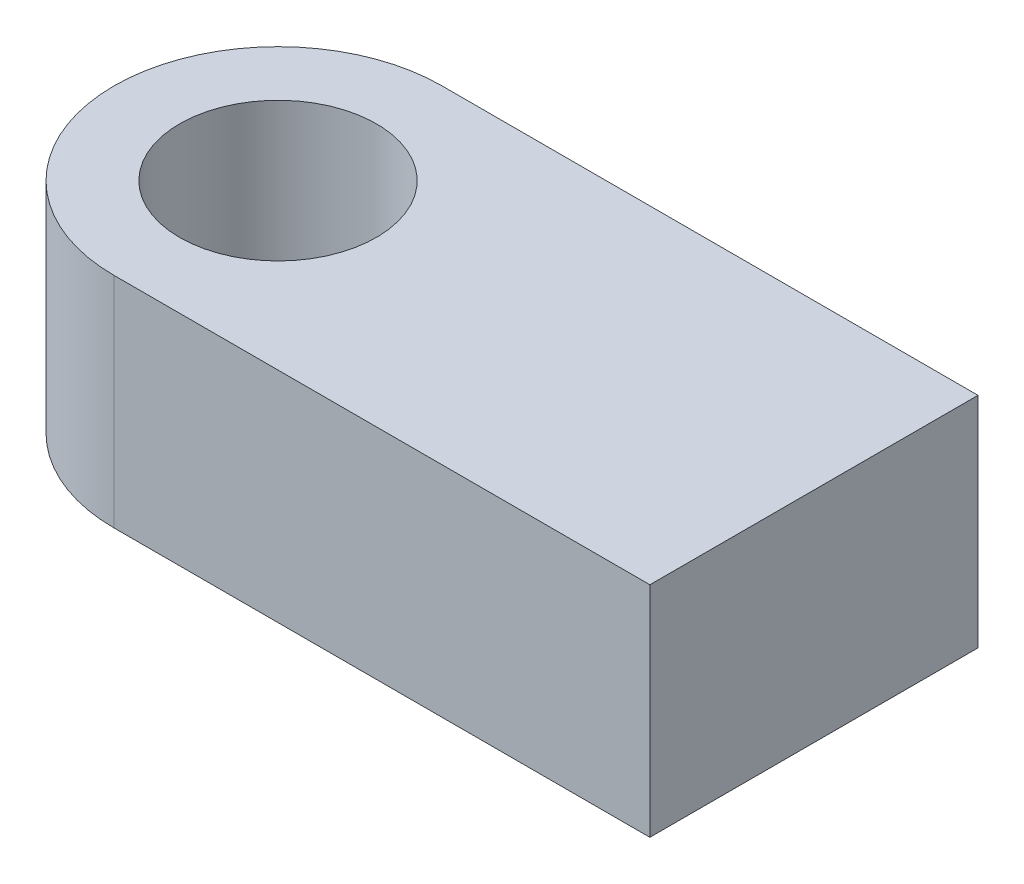
from build123d import *

# Parameters (mm, degrees)
SKETCH_1_R      = 4.5
EXTRUDE_1_DEPTH = 10


with BuildPart() as part:
    # Эскиз1 → Бобышка-Вытянуть1 (new body)
    with BuildSketch(Plane(origin=(0, 0, 0), x_dir=(1, 0, 0), z_dir=(0, 1, 0))):
        with BuildLine():
            Line((24.5, -7.5), (0, -7.5))
            ThreePointArc((0, -7.5), (-7.5, 0), (0, 7.5))
            Line((0, 7.5), (24.5, 7.5))
            Line((24.5, 7.5), (24.5, -7.5))
        make_face()
        with Locations(Location((0, 0, 0), (0, 0, 270))):
            Circle(SKETCH_1_R, mode=Mode.SUBTRACT)
    extrude(amount=EXTRUDE_1_DEPTH)


solid = part.part
